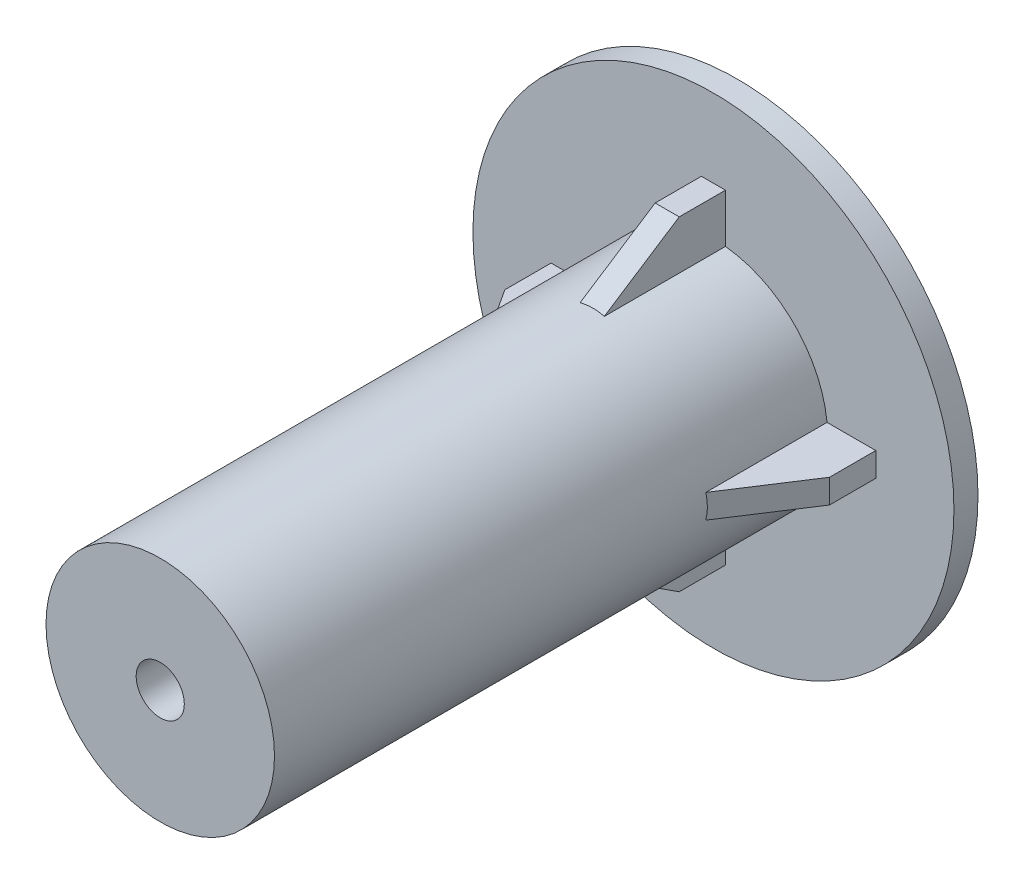
from build123d import *

# Parameters (mm, degrees)
SKETCH1_R           = 47.5
BOSS_EXTRUDE1_DEPTH = 230
SKETCH2_R           = 10
CUT_EXTRUDE1_DEPTH  = 20
SKETCH3_R           = 100
BOSS_EXTRUDE2_DEPTH = 10
RIB1_REACH          = 272
SKETCH4_WALL_W      = 601.63430221
SKETCH4_WALL_H      = 10
CIRPATTERN1_COUNT   = 4
SKETCH7_OUTSIDE_W   = 276.188
SKETCH7_OUTSIDE_H   = 276.188
SKETCH7_OUTSIDE_W_2 = 135
SKETCH7_OUTSIDE_H_2 = 135
CUT_EXTRUDE2_DEPTH  = 73


with BuildPart() as part:
    # Sketch1 → Boss-Extrude1 (new body)
    with BuildSketch(Plane.XY):
        Circle(SKETCH1_R)
    extrude(amount=BOSS_EXTRUDE1_DEPTH)

    # Sketch2 → Cut-Extrude1 (cut)
    with BuildSketch(Plane.XY.offset(230)):
        Circle(SKETCH2_R)
    extrude(amount=-CUT_EXTRUDE1_DEPTH, mode=Mode.SUBTRACT)

    # Sketch3 → Boss-Extrude2 (add)
    with BuildSketch(Plane(origin=(0, 0, 0), x_dir=(-1, 0, 0), z_dir=(0, 0, -1))):
        Circle(SKETCH3_R)
    extrude(amount=BOSS_EXTRUDE2_DEPTH)

    # Sketch4 wall → Rib1 (add, up to next)
    with BuildSketch(Plane(origin=(-63.75, 0, 25), x_dir=(-0.544988350595, 0, -0.838443616301), z_dir=(-0.838443616301, 0, 0.544988350595)), mode=Mode.PRIVATE) as rib1_sk1:
        Rectangle(SKETCH4_WALL_W, SKETCH4_WALL_H)
    rib1_tool1 = extrude(rib1_sk1.sketch, amount=-RIB1_REACH, mode=Mode.PRIVATE) - part.part
    rib1 = rib1_tool1.solids().sort_by_distance((-63.75, 0, 25))[0]
    add(rib1)

    # CirPattern1: Rib1 ×4 about axis
    cirpattern1_axis = Axis((0, 0, 0), (0, 0, 1))
    for i in range(1, CIRPATTERN1_COUNT):
        add(rib1.rotate(cirpattern1_axis, i * 360 / CIRPATTERN1_COUNT))

    # Sketch7 outside → Cut-Extrude2 (cut)
    with BuildSketch(Plane.XY):
        Rectangle(SKETCH7_OUTSIDE_W, SKETCH7_OUTSIDE_H)
        Rectangle(SKETCH7_OUTSIDE_W_2, SKETCH7_OUTSIDE_H_2, mode=Mode.SUBTRACT)
    extrude(amount=CUT_EXTRUDE2_DEPTH, mode=Mode.SUBTRACT)


solid = part.part
